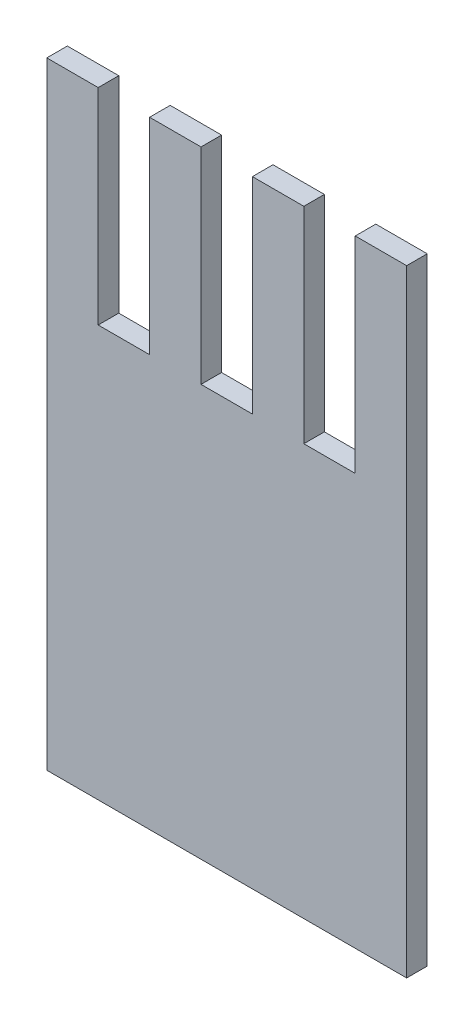
from build123d import *

# Parameters (mm, degrees)
SKETCH1_W           = 35
SKETCH1_H           = 30
BOSS_EXTRUDE5_DEPTH = 2
BOSS_EXTRUDE6_DEPTH = 2


with BuildPart() as part:
    # Sketch1 → Boss-Extrude5 (new body)
    with BuildSketch(Plane.XY):
        with Locations((0, -15)):
            Rectangle(SKETCH1_W, SKETCH1_H)
    extrude(amount=BOSS_EXTRUDE5_DEPTH)

    # Sketch1<7> → Boss-Extrude6 (add)
    with BuildSketch(Plane.XY):
        Polygon((-12.5, 10), (-12.5, 30), (-17.5, 30), (-17.5, 10), (-17.5, 0), (17.5, 0), (17.5, 10), (17.5, 30), (12.5, 30), (12.5, 10), (7.5, 10), (7.5, 30), (2.5, 30), (2.5, 10), (-2.5, 10), (-2.5, 30), (-7.5, 30), (-7.5, 10), align=None)
    extrude(amount=BOSS_EXTRUDE6_DEPTH)


solid = part.part
